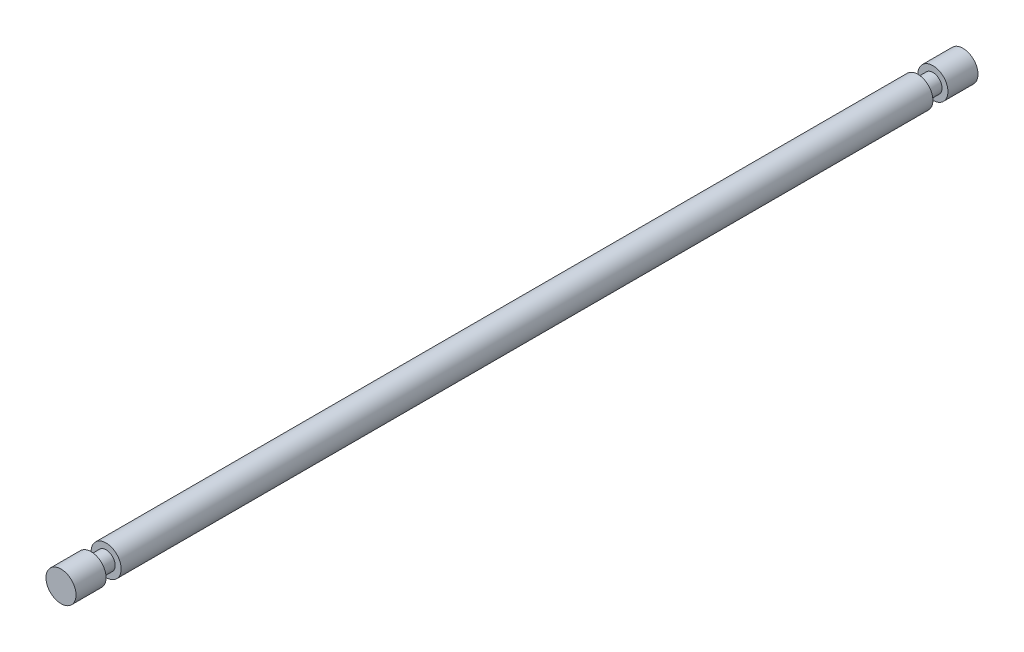
from build123d import *

# Parameters (mm, degrees)
SKETCH2_W = 1.27
SKETCH2_H = 76.2
SKETCH3_W = 0.499412869
SKETCH3_H = 1.27


with BuildPart() as part:
    # Sketch2 → Revolve1 (revolve)
    with BuildSketch(Plane(origin=(0, 0, 0), x_dir=(1, 0, 0), z_dir=(0, 1, 0))):
        with Locations((0.635, 38.1)):
            Rectangle(SKETCH2_W, SKETCH2_H)
    revolve(axis=Axis((0, 0, 0), (0, 0, -1)))

    # Sketch3 → Cut-Revolve1 (revolve, cut)
    with BuildSketch(Plane(origin=(0, 0, 0), x_dir=(1, 0, 0), z_dir=(0, 1, 0))):
        with Locations((1.020293566, 3.175)):
            Rectangle(SKETCH3_W, SKETCH3_H)
    cut_revolve1 = revolve(axis=Axis((0, 0, 0), (0, 0, -1)), mode=Mode.SUBTRACT)

    # Mirror1: Cut-Revolve1 across plane
    add(cut_revolve1.mirror(Plane.XY.offset(-38.1)), mode=Mode.SUBTRACT)


solid = part.part
